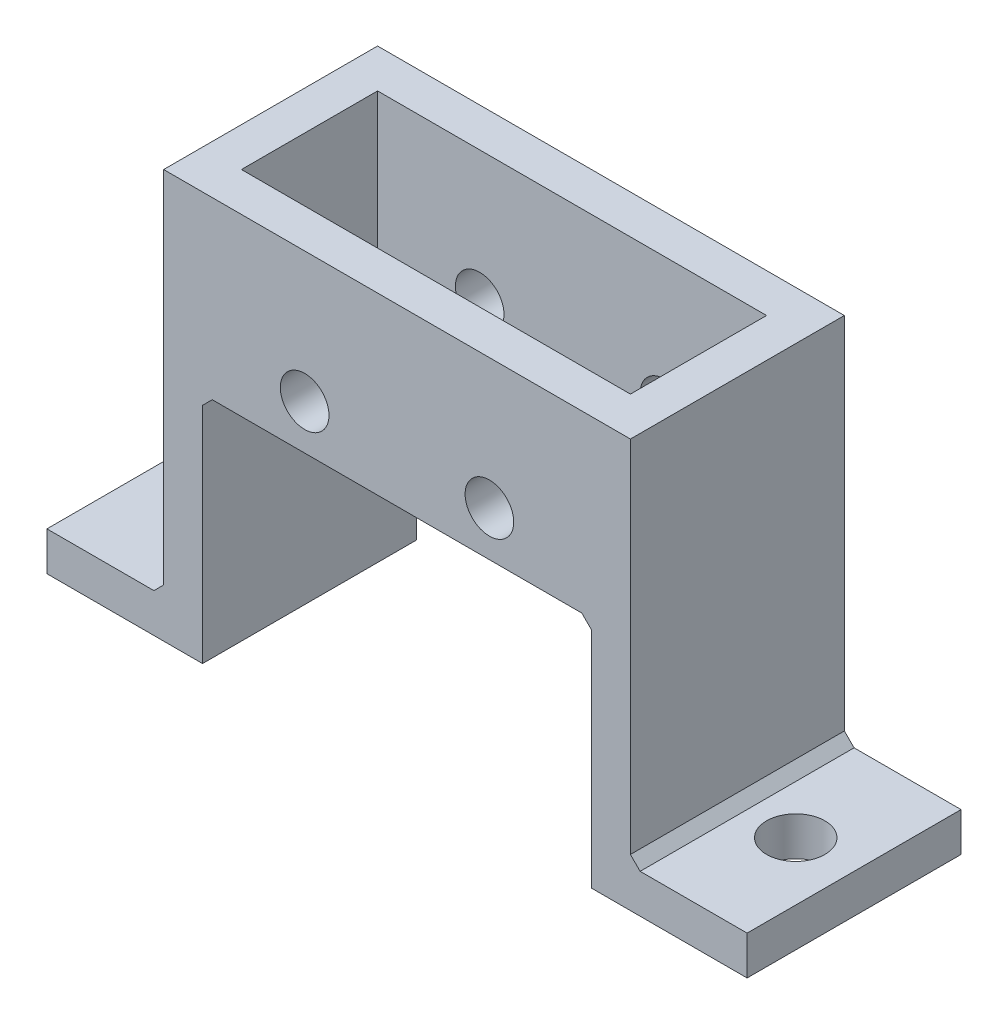
from build123d import *

# Parameters (mm, degrees)
CROQUIS1_W              = 20
CROQUIS1_H              = 10
CROQUIS1_R              = 1.25
SALIENTE_EXTRUIR1_DEPTH = 2
CROQUIS2_W              = 2
CROQUIS2_H              = 10
SALIENTE_EXTRUIR2_DEPTH = 11
CROQUIS3_W              = 20
CROQUIS3_H              = 10
CROQUIS3_R              = 1.25
SALIENTE_EXTRUIR3_DEPTH = 2
CROQUIS4_W              = 2
CROQUIS4_H              = 11
SALIENTE_EXTRUIR4_DEPTH = 12
CROQUIS5_W              = 11
CROQUIS5_H              = 2
SALIENTE_EXTRUIR5_DEPTH = 6
CROQUIS6_W              = 11
CROQUIS6_H              = 2
SALIENTE_EXTRUIR6_DEPTH = 6
CROQUIS7_W              = 24
CROQUIS7_H              = 11
CROQUIS7_W_2            = 20
CROQUIS7_H_2            = 7
CORTAR_EXTRUIR1_DEPTH   = 1
CROQUIS8_R              = 1.5
CORTAR_EXTRUIR2_DEPTH   = 11
CHAFL_N1_SIZE           = 0.5


with BuildPart() as part:
    # Croquis1 → Saliente-Extruir1 (new body)
    with BuildSketch(Plane.XY):
        with Locations((10, 5)):
            Rectangle(CROQUIS1_W, CROQUIS1_H)
        with Locations((5.25, 2.3)):
            Circle(CROQUIS1_R, mode=Mode.SUBTRACT)
        with Locations((14.75, 2.3)):
            Circle(CROQUIS1_R, mode=Mode.SUBTRACT)
    extrude(amount=SALIENTE_EXTRUIR1_DEPTH)

    # Croquis2 → Saliente-Extruir2 (add)
    with BuildSketch(Plane.XY.offset(2)):
        with Locations((-1, 5)):
            Rectangle(CROQUIS2_W, CROQUIS2_H)
        with Locations((21, 5)):
            Rectangle(CROQUIS2_W, CROQUIS2_H)
    extrude(amount=-SALIENTE_EXTRUIR2_DEPTH)



with BuildPart() as body_2:
    # Croquis3 → Saliente-Extruir3 (new body)
    with BuildSketch(Plane(origin=(0, 0, -9), x_dir=(-1, 0, 0), z_dir=(0, 0, -1))):
        with Locations((-10, 5)):
            Rectangle(CROQUIS3_W, CROQUIS3_H)
        with Locations(Location((-5.25, 2.3, 0), (0, 0, 180))):
            Circle(CROQUIS3_R, mode=Mode.SUBTRACT)
        with Locations(Location((-14.75, 2.3, 0), (0, 0, 180))):
            Circle(CROQUIS3_R, mode=Mode.SUBTRACT)
    extrude(amount=-SALIENTE_EXTRUIR3_DEPTH)


with BuildPart() as part_1:
    add(part.part)

    add(body_2.part)  # Saliente-Extruir4 merges body 2
    # Croquis4 → Saliente-Extruir4 (add)
    with BuildSketch(Plane.XZ):
        with Locations((-1, -3.5)):
            Rectangle(CROQUIS4_W, CROQUIS4_H)
        with Locations((21, -3.5)):
            Rectangle(CROQUIS4_W, CROQUIS4_H)
    extrude(amount=SALIENTE_EXTRUIR4_DEPTH)

    # Croquis5 → Saliente-Extruir5 (add)
    with BuildSketch(Plane(origin=(22, 0, 0), x_dir=(0, 0, -1), z_dir=(1, 0, 0))):
        with Locations((3.5, -11)):
            Rectangle(CROQUIS5_W, CROQUIS5_H)
    extrude(amount=SALIENTE_EXTRUIR5_DEPTH)

    # Croquis6 → Saliente-Extruir6 (add)
    with BuildSketch(Plane.ZY.offset(2)):
        with Locations((-3.5, -11)):
            Rectangle(CROQUIS6_W, CROQUIS6_H)
    extrude(amount=SALIENTE_EXTRUIR6_DEPTH)

    # Croquis7 → Cortar-Extruir1 (cut)
    with BuildSketch(Plane(origin=(0, 10, 0), x_dir=(1, 0, 0), z_dir=(0, 1, 0))):
        with Locations((10, 3.5)):
            Rectangle(CROQUIS7_W, CROQUIS7_H)
        with Locations((10, 3.5)):
            Rectangle(CROQUIS7_W_2, CROQUIS7_H_2, mode=Mode.SUBTRACT)
    extrude(amount=-CORTAR_EXTRUIR1_DEPTH, mode=Mode.SUBTRACT)

    # Croquis8 → Cortar-Extruir2 (cut)
    with BuildSketch(Plane(origin=(0, -10, 0), x_dir=(1, 0, 0), z_dir=(0, 1, 0))):
        with Locations(Location((-5, 3.5, 0), (0, 0, 180))):
            Circle(CROQUIS8_R)
        with Locations(Location((25, 3.5, 0), (0, 0, 180))):
            Circle(CROQUIS8_R)
    extrude(amount=-CORTAR_EXTRUIR2_DEPTH, mode=Mode.SUBTRACT)

    # Chaflán1
    chafl_n1_edges = [part_1.edges().sort_by_distance(p)[0] for p in [
        (-2, -10, -3.5),
        (0, 0, 1),
        (0, 0, -8),
        (20, 0, 1),
        (20, 0, -8),
        (22, -10, -3.5),
    ]]
    chamfer(chafl_n1_edges, length=CHAFL_N1_SIZE)


solid = part_1.part
